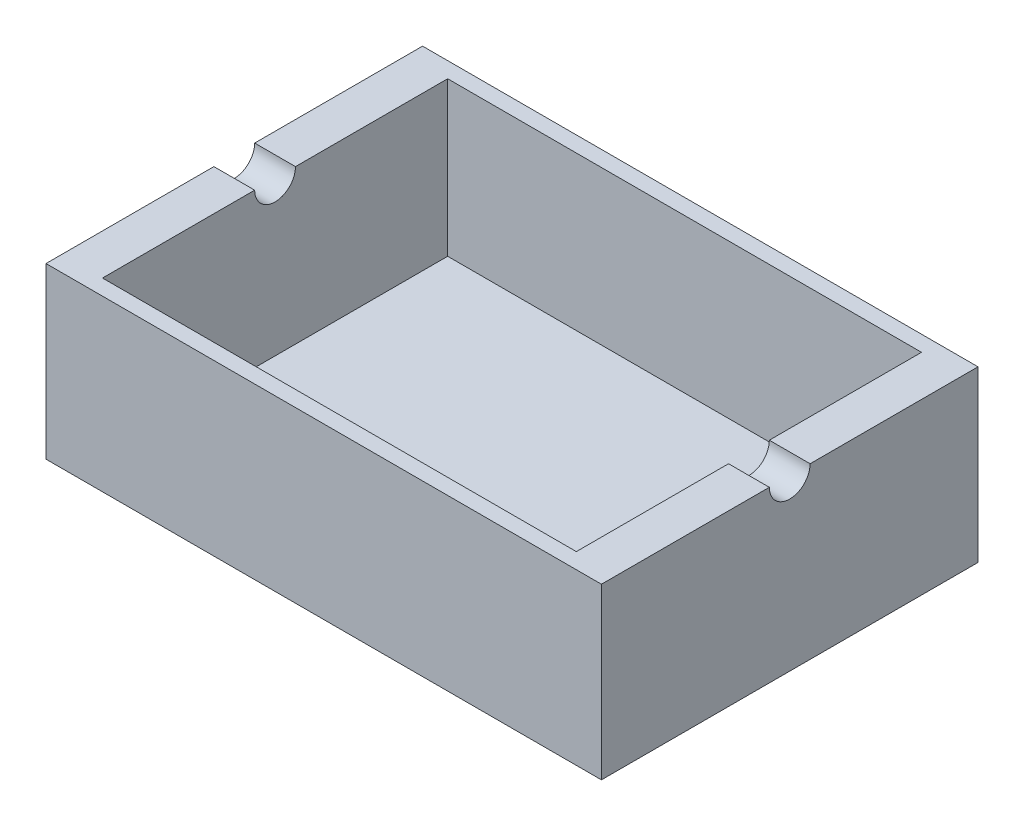
from build123d import *

# Parameters (mm, degrees)
CROQUIS1_W              = 70.8
CROQUIS1_H              = 48
CROQUIS1_W_2            = 60.4
CROQUIS1_H_2            = 44
SALIENTE_EXTRUIR1_DEPTH = 19.6
CROQUIS1_2_W            = 70.8
CROQUIS1_2_H            = 48
CROQUIS1_2_W_2          = 60.4
CROQUIS1_2_H_2          = 44
SALIENTE_EXTRUIR2_DEPTH = 2
CORTAR_EXTRUIR1_REACH   = 79.284


with BuildPart() as part:
    # Croquis1 → Saliente-Extruir1 (new body)
    with BuildSketch(Plane(origin=(0, 0, 0), x_dir=(1, 0, 0), z_dir=(0, 1, 0))):
        Rectangle(CROQUIS1_W, CROQUIS1_H)
        Rectangle(CROQUIS1_W_2, CROQUIS1_H_2, mode=Mode.SUBTRACT)
    extrude(amount=SALIENTE_EXTRUIR1_DEPTH)

    # Croquis1<2> → Saliente-Extruir2 (add)
    # profile 1 of 2: a face of its own
    with BuildSketch(Plane(origin=(0, 0, 0), x_dir=(1, 0, 0), z_dir=(0, 1, 0))):
        Rectangle(CROQUIS1_2_W, CROQUIS1_2_H)
        Rectangle(CROQUIS1_2_W_2, CROQUIS1_2_H_2, mode=Mode.SUBTRACT)
    # profile 2 of 2: a face of its own
    with BuildSketch(Plane(origin=(0, 0, 0), x_dir=(1, 0, 0), z_dir=(0, 1, 0))):
        Rectangle(CROQUIS1_2_W_2, CROQUIS1_2_H_2)
    extrude(amount=-SALIENTE_EXTRUIR2_DEPTH)

    # Cortar-Extruir1: up to this face of the body (flat: up to its plane)
    cortar_extruir1_end = Plane(part.part.faces().sort_by_distance((-35.4, 8.8, 0))[0])
    # Croquis2 → Cortar-Extruir1 (cut, up to the picked face)
    with BuildSketch(Plane(origin=(35.4, 0, 0), x_dir=(0, 0, -1), z_dir=(1, 0, 0)), mode=Mode.PRIVATE) as cortar_extruir1_sk1:
        with BuildLine():
            Line((-2.6, 19.6), (2.6, 19.6))
            ThreePointArc((2.6, 19.6), (0, 17), (-2.6, 19.6))
        make_face()
    cortar_extruir1_tool1 = split(extrude(cortar_extruir1_sk1.sketch, amount=-CORTAR_EXTRUIR1_REACH, mode=Mode.PRIVATE), bisect_by=cortar_extruir1_end, keep=Keep.BOTH, mode=Mode.PRIVATE)
    add(cortar_extruir1_tool1.solids().sort_by(Axis((35.4, 18.496526, 0), (-1, 0, 0)))[0], mode=Mode.SUBTRACT)


solid = part.part
